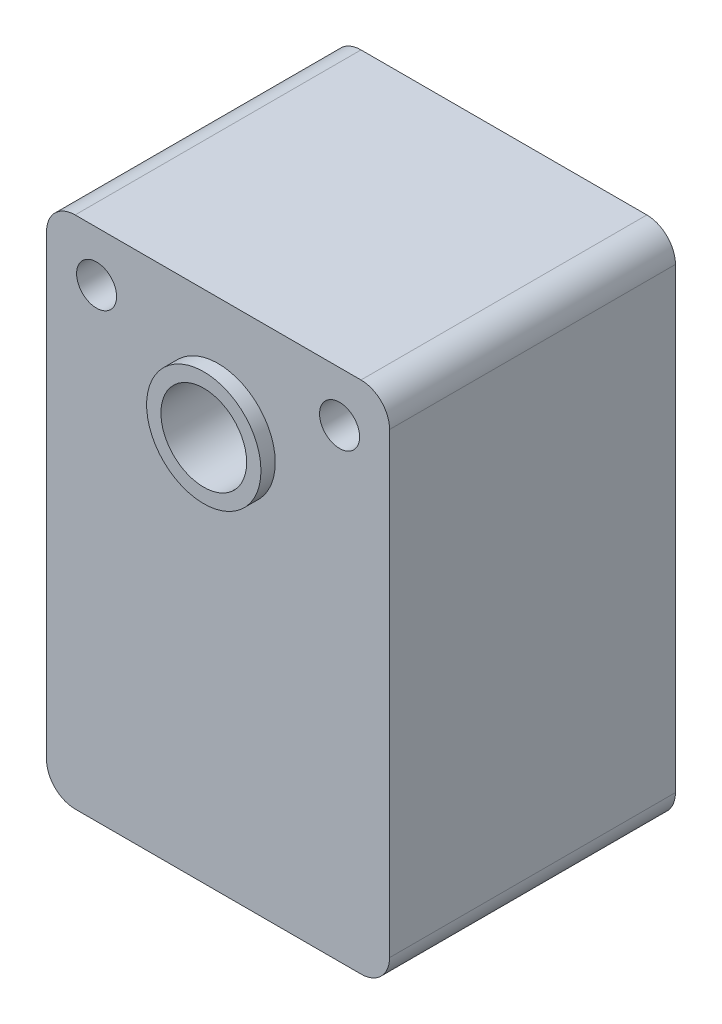
from build123d import *

# Parameters (mm, degrees)
SKETCH_1_W      = 12
SKETCH_1_H      = 18
SKETCH_1_R      = 1.5
SKETCH_1_R_2    = 0.7
EXTRUDE_1_DEPTH = 10
SKETCH_2_R      = 2
SKETCH_2_R_2    = 1.5
EXTRUDE_2_DEPTH = 0.5
FILLET_1_R      = 1


with BuildPart() as part:
    # 草图1 → 凸台-拉伸1 (new body)
    with BuildSketch(Plane.XY):
        Rectangle(SKETCH_1_W, SKETCH_1_H)
        with Locations((0, 5)):
            Circle(SKETCH_1_R, mode=Mode.SUBTRACT)
        with Locations((-4.25, 7.25)):
            Circle(SKETCH_1_R_2, mode=Mode.SUBTRACT)
        with Locations(Location((4.25, 7.25, 0), (0, 0, 180))):
            Circle(SKETCH_1_R_2, mode=Mode.SUBTRACT)
    extrude(amount=EXTRUDE_1_DEPTH)

    # 草图2 → 凸台-拉伸2 (add)
    with BuildSketch(Plane.XY.offset(10)):
        with Locations((0, 5)):
            Circle(SKETCH_2_R)
        with Locations((0, 5)):
            Circle(SKETCH_2_R_2, mode=Mode.SUBTRACT)
    extrude(amount=EXTRUDE_2_DEPTH)

    # 圆角1
    fillet_1_edges = [part.edges().sort_by_distance(p)[0] for p in [
        (-6, 9, 5),
        (6, 9, 5),
        (6, -9, 5),
        (-6, -9, 5),
    ]]
    fillet(fillet_1_edges, radius=FILLET_1_R)


solid = part.part
